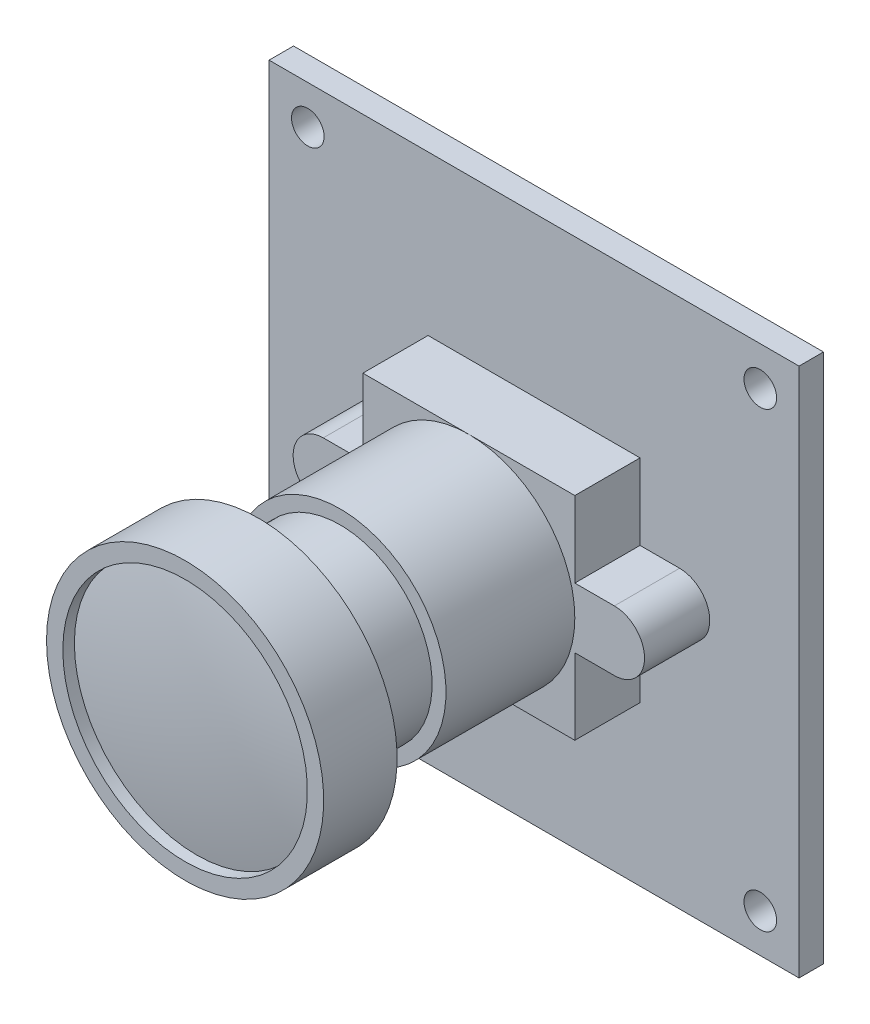
from build123d import *

# Parameters (mm, degrees)
SKETCH2_W           = 32.5
SKETCH2_H           = 32.5
SKETCH2_R           = 1
BOSS_EXTRUDE1_DEPTH = 1.5
SKETCH4_W           = 13
SKETCH4_H           = 13
BOSS_EXTRUDE2_DEPTH = 4
SKETCH6_W           = 10
SKETCH6_H           = 4.75
BOSS_EXTRUDE3_DEPTH = 6


with BuildPart() as part:
    # Sketch2 → Boss-Extrude1 (new body)
    with BuildSketch(Plane.XY):
        Rectangle(SKETCH2_W, SKETCH2_H)
        with Locations((13.875, 13.875)):
            Circle(SKETCH2_R, mode=Mode.SUBTRACT)
        with Locations((13.875, -13.875)):
            Circle(SKETCH2_R, mode=Mode.SUBTRACT)
        with Locations((-13.875, -13.875)):
            Circle(SKETCH2_R, mode=Mode.SUBTRACT)
        with Locations((-13.875, 13.875)):
            Circle(SKETCH2_R, mode=Mode.SUBTRACT)
    extrude(amount=BOSS_EXTRUDE1_DEPTH)

    # Sketch4 → Boss-Extrude2 (add)
    with BuildSketch(Plane.XY.offset(1.5)):
        Rectangle(SKETCH4_W, SKETCH4_H)
        with BuildLine():
            Line((8.925, -1.85), (-8.925, -1.85))
            ThreePointArc((-8.925, -1.85), (-10.775, 0), (-8.925, 1.85))
            Line((-8.925, 1.85), (8.925, 1.85))
            ThreePointArc((8.925, 1.85), (10.775, 0), (8.925, -1.85))
        make_face()
    extrude(amount=BOSS_EXTRUDE2_DEPTH)

    # Sketch5 → Revolve1 (revolve)
    with BuildSketch(Plane(origin=(0, 0, 0), x_dir=(1, 0, 0), z_dir=(0, 1, 0)), mode=Mode.PRIVATE) as revolve1_sk:
        with BuildLine():
            Line((0, -5.5), (6.5, -5.5))
            Line((6.5, -5.5), (6.5, -13.4))
            Line((6.5, -13.4), (5.65, -13.4))
            Line((5.65, -13.4), (5.65, -18.4))
            Line((5.65, -18.4), (8.5, -18.4))
            Line((8.5, -18.4), (8.5, -22.9))
            Line((8.5, -22.9), (7.5, -22.9))
            Line((7.5, -22.9), (7.5, -22.190584114))
            ThreePointArc((7.5, -22.190584114), (3.76673834, -22.722251095), (0, -22.9))
            Line((0, -22.9), (0, -5.5))
        make_face()
    revolve(revolve1_sk.sketch.rotate(Axis((0, 0, 0), (0, 0, 1)), 180), axis=Axis((0, 0, 0), (0, 0, 1)))

    # Sketch6 → Boss-Extrude3 (add)
    with BuildSketch(Plane(origin=(0, 0, 0), x_dir=(-1, 0, 0), z_dir=(0, 0, -1))):
        with Locations((0, -13.875)):
            Rectangle(SKETCH6_W, SKETCH6_H)
    extrude(amount=BOSS_EXTRUDE3_DEPTH)


solid = part.part
